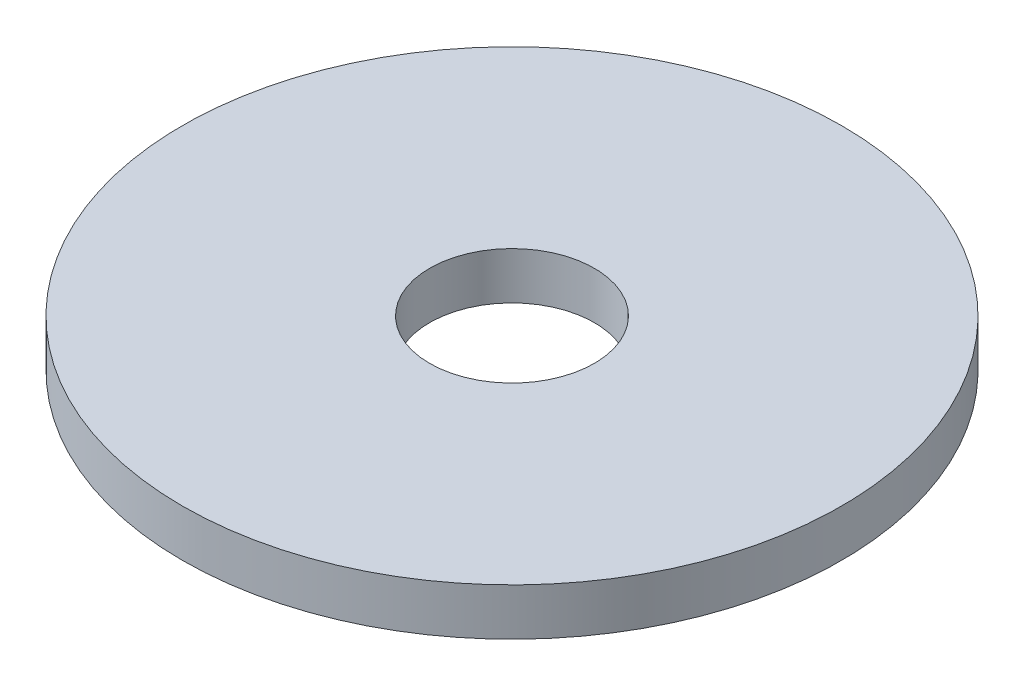
from build123d import *

# Parameters (mm, degrees)
SKETCH1_R           = 70
SKETCH1_R_2         = 17.5
BOSS_EXTRUDE1_DEPTH = 5


with BuildPart() as part:
    # Sketch1 → Boss-Extrude1 (new, symmetric)
    with BuildSketch(Plane(origin=(0, 0, 0), x_dir=(1, 0, 0), z_dir=(0, 1, 0))):
        with Locations(Location((0, 0, 0), (0, 0, 270))):
            Circle(SKETCH1_R)
        with Locations(Location((0, 0, 0), (0, 0, 270))):
            Circle(SKETCH1_R_2, mode=Mode.SUBTRACT)
    extrude(amount=BOSS_EXTRUDE1_DEPTH, both=True)


solid = part.part
